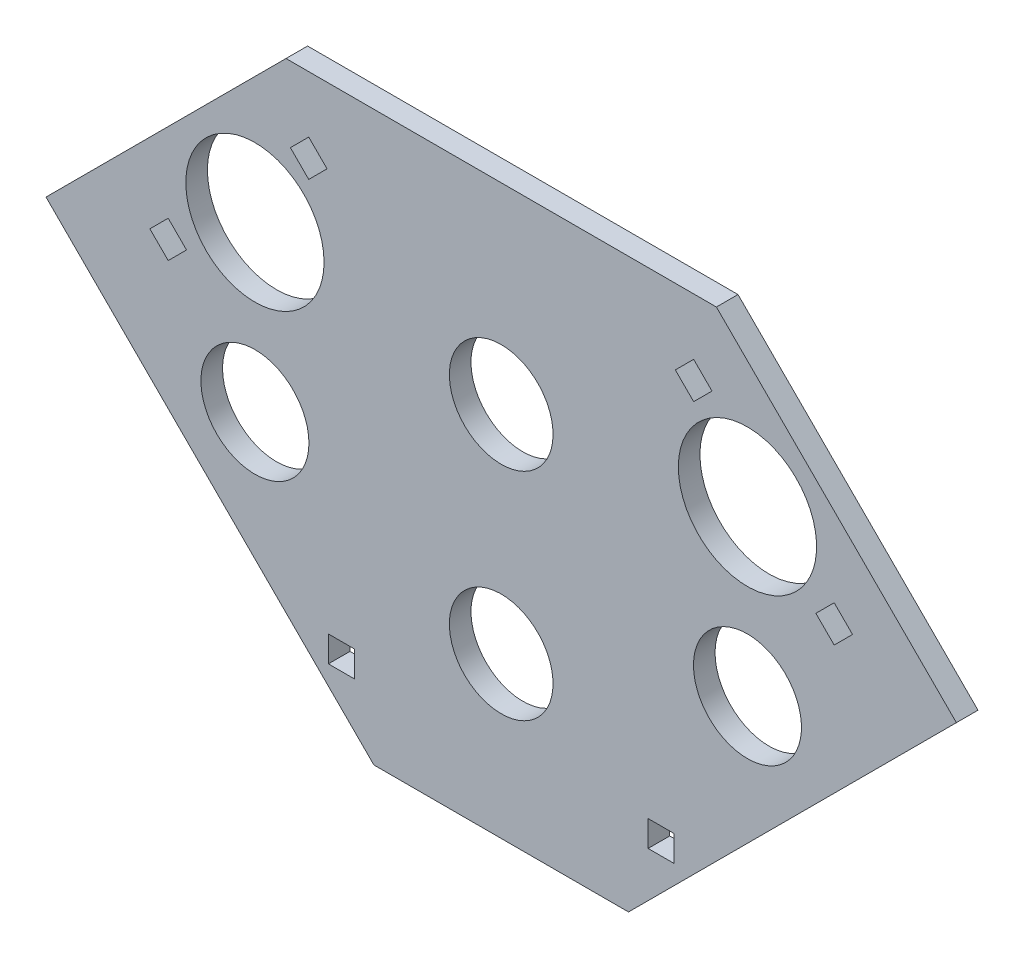
from build123d import *

# Parameters (mm, degrees)
SKETCH3_R           = 12
BOSS_EXTRUDE1_DEPTH = 5
BOSS_EXTRUDE2_DEPTH = 5
SKETCH6_R           = 16
SKETCH6_R_2         = 12.5
SKETCH6_W           = 6
SKETCH6_H           = 6
CUT_EXTRUDE1_DEPTH  = 5
SKETCH7_R           = 7.5
BOSS_EXTRUDE3_DEPTH = 10
SKETCH8_R           = 9.5
SKETCH8_R_2         = 7.5
BOSS_EXTRUDE4_DEPTH = 2.5


with BuildPart() as part:
    # Sketch3 → Boss-Extrude1 (new body)
    with BuildSketch(Plane.XY):
        Polygon((-77.781745931, 49.497474683), (-49.497474683, 77.781745931), (-43.840620434, 83.43860018), (43.840620434, 83.43860018), (49.497474683, 77.781745931), (77.781745931, 49.497474683), (88.388347648, 38.890872965), (27.497474683, -22), (-27.497474683, -22), (-88.388347648, 38.890872965), align=None)
        Circle(SKETCH3_R, mode=Mode.SUBTRACT)
        with Locations((0, 50)):
            Circle(SKETCH3_R, mode=Mode.SUBTRACT)
        Polygon((-81.317279836, 44.547727215), (-77.074639149, 48.790367902), (-72.831998462, 44.547727215), (-77.074639149, 40.305086528), align=None, mode=Mode.SUBTRACT)
        Polygon((-48.790367902, 77.074639149), (-44.547727215, 81.317279836), (-40.305086528, 77.074639149), (-44.547727215, 72.831998462), align=None, mode=Mode.SUBTRACT)
        Polygon((40.305086528, 77.074639149), (44.547727215, 72.831998462), (48.790367902, 77.074639149), (44.547727215, 81.317279836), align=None, mode=Mode.SUBTRACT)
        Polygon((72.831998462, 44.547727215), (77.074639149, 40.305086528), (81.317279836, 44.547727215), (77.074639149, 48.790367902), align=None, mode=Mode.SUBTRACT)
    extrude(amount=BOSS_EXTRUDE1_DEPTH)

    # Sketch5 → Boss-Extrude2 (add)
    with BuildSketch(Plane.XY.offset(5)):
        Polygon((-105.358910397, 38.890872965), (-49.811183182, 94.43860018), (49.811183182, 94.43860018), (105.358910397, 38.890872965), (29.468037432, -37), (-29.468037432, -37), align=None)
        Polygon((-43.840620434, 83.43860018), (-88.388347648, 38.890872965), (-27.497474683, -22), (27.497474683, -22), (88.388347648, 38.890872965), (43.840620434, 83.43860018), align=None, mode=Mode.SUBTRACT)
    extrude(amount=-BOSS_EXTRUDE2_DEPTH)

    # Sketch6 → Cut-Extrude1 (cut)
    with BuildSketch(Plane.XY.offset(5)):
        with Locations((-57, 58)):
            Circle(SKETCH6_R)
        with Locations((-57, 20)):
            Circle(SKETCH6_R_2)
        with Locations(Location((57, 20, 0), (0, 0, 180))):
            Circle(SKETCH6_R_2)
        with Locations(Location((57, 58, 0), (0, 0, 180))):
            Circle(SKETCH6_R)
        with Locations((-37, -19)):
            Rectangle(SKETCH6_W, SKETCH6_H)
        with Locations((37, -19)):
            Rectangle(SKETCH6_W, SKETCH6_H)
    extrude(amount=-CUT_EXTRUDE1_DEPTH, mode=Mode.SUBTRACT)

    # Sketch7 → Boss-Extrude3 (add)
    with BuildSketch(Plane.XY):
        with Locations((21.11953, 11.4)):
            Circle(SKETCH7_R)
    extrude(amount=-BOSS_EXTRUDE3_DEPTH)

    # Sketch8 → Boss-Extrude4 (add)
    with BuildSketch(Plane(origin=(0, 0, 0), x_dir=(-1, 0, 0), z_dir=(0, 0, -1))):
        with Locations((-21.11953, 11.4)):
            Circle(SKETCH8_R)
        with Locations(Location((-21.11953, 11.4, 0), (0, 0, 180))):
            Circle(SKETCH8_R_2, mode=Mode.SUBTRACT)
    extrude(amount=BOSS_EXTRUDE4_DEPTH)


solid = part.part
